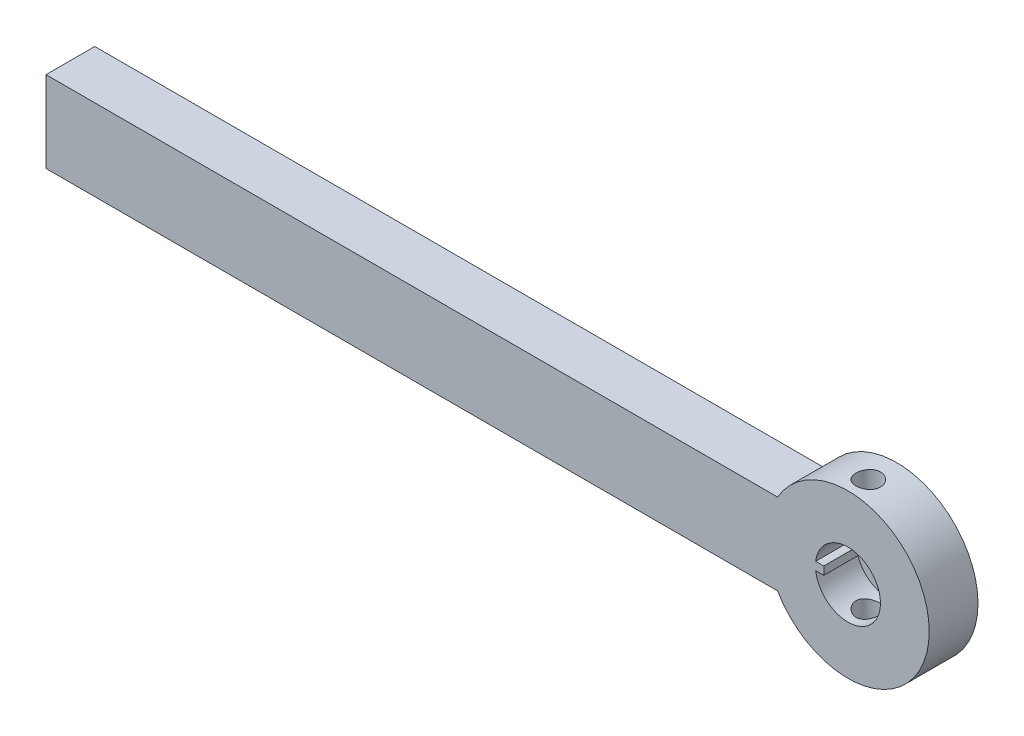
from build123d import *

# Parameters (mm, degrees)
BOSS_EXTRUDE1_DEPTH = 6
SKETCH2_R           = 4
CUT_EXTRUDE1_DEPTH  = 5
SKETCH3_R           = 1.5
CUT_EXTRUDE2_DEPTH  = 24
BOSS_EXTRUDE2_DEPTH = 5


with BuildPart() as part:
    # Sketch1 → Boss-Extrude1 (new body)
    with BuildSketch(Plane.XY):
        with BuildLine():
            Line((-98.660254038, 5), (-8.660254038, 5))
            ThreePointArc((-8.660254038, 5), (10, 0), (-8.660254038, -5))
            Line((-8.660254038, -5), (-98.660254038, -5))
            Line((-98.660254038, -5), (-98.660254038, 5))
        make_face()
    extrude(amount=BOSS_EXTRUDE1_DEPTH)

    # Sketch2 → Cut-Extrude1 (cut)
    with BuildSketch(Plane.XY.offset(6)):
        Circle(SKETCH2_R)
    extrude(amount=-CUT_EXTRUDE1_DEPTH, mode=Mode.SUBTRACT)

    # Sketch3 → Cut-Extrude2 (cut)
    with BuildSketch(Plane(origin=(0, -10, 0), x_dir=(-1, 0, 0), z_dir=(0, -1, 0))):
        with Locations(Location((0, -3.5, 0), (0, 0, 90))):
            Circle(SKETCH3_R)
    extrude(amount=-CUT_EXTRUDE2_DEPTH, mode=Mode.SUBTRACT)

    # Sketch4 → Boss-Extrude2 (add)
    with BuildSketch(Plane.XY.offset(6)):
        with BuildLine():
            Line((-3.968626967, 0.5), (-2.968626967, 0.5))
            Line((-2.968626967, 0.5), (-2.968626967, -0.5))
            Line((-2.968626967, -0.5), (-3.968626967, -0.5))
            ThreePointArc((-3.968626967, -0.5), (-4, 0), (-3.968626967, 0.5))
        make_face()
    extrude(amount=-BOSS_EXTRUDE2_DEPTH)


solid = part.part
